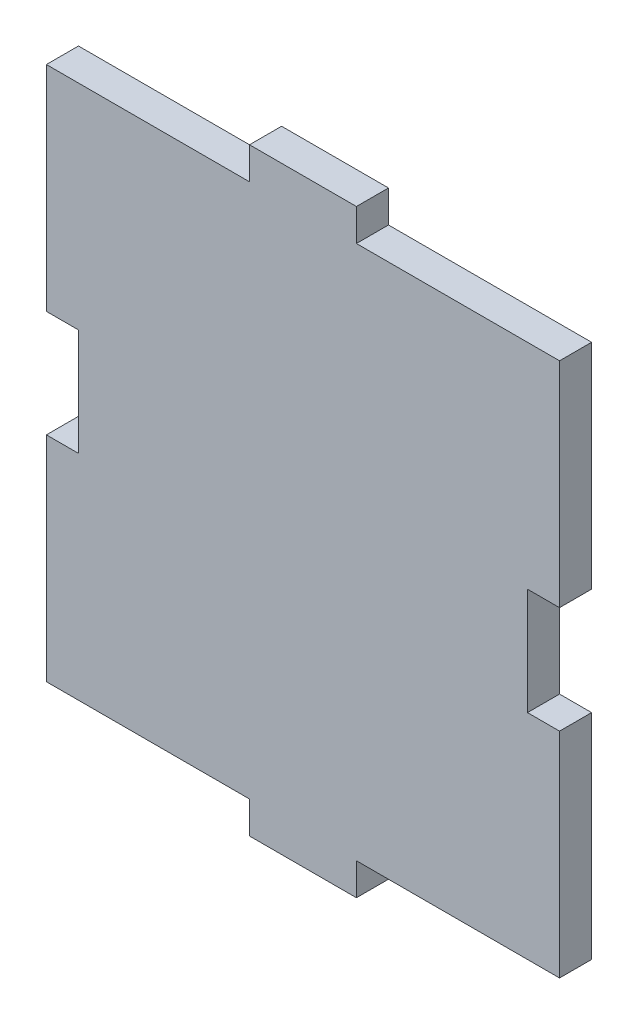
from build123d import *

# Parameters (mm, degrees)
BOSS_EXTRUDE1_DEPTH = 3


with BuildPart() as part:
    # Sketch1 → Boss-Extrude1 (new body)
    with BuildSketch(Plane.XY):
        Polygon((-5, -25), (-5, -28), (5, -28), (5, -25), (24, -25), (24, -5), (21, -5), (21, 5), (24, 5), (24, 25), (5, 25), (5, 28), (-5, 28), (-5, 25), (-24, 25), (-24, 5), (-21, 5), (-21, -5), (-24, -5), (-24, -25), align=None)
    extrude(amount=BOSS_EXTRUDE1_DEPTH)


solid = part.part
